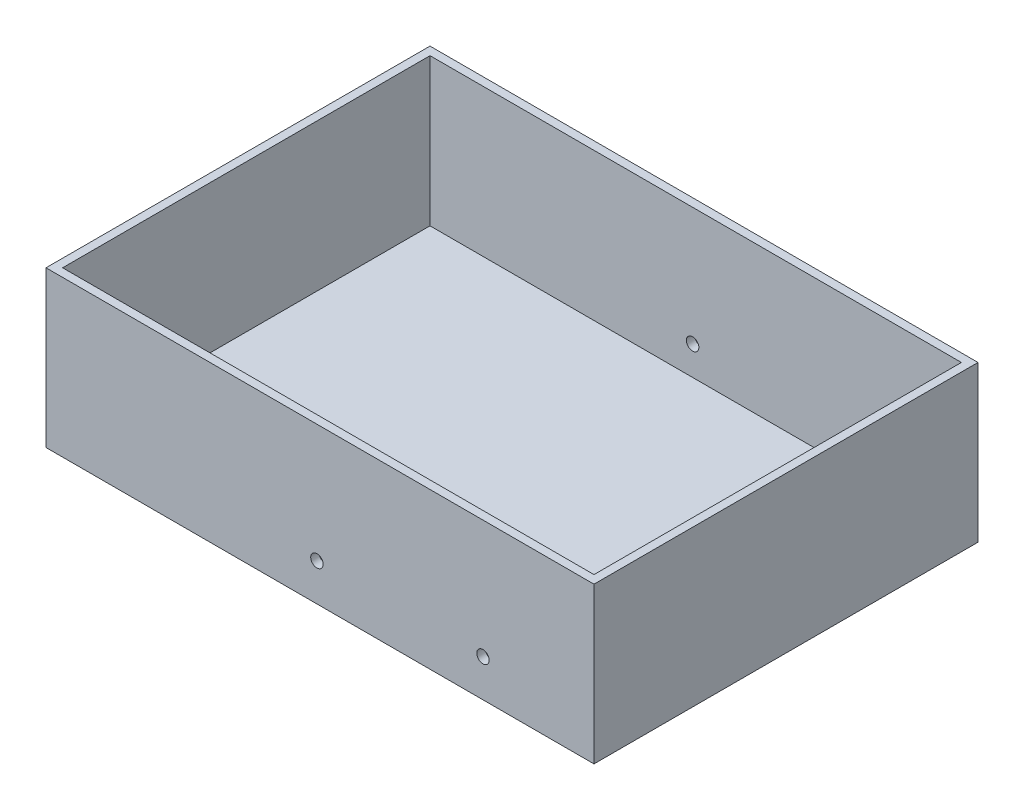
from build123d import *

# Parameters (mm, degrees)
SKETCH1_W           = 264
SKETCH1_H           = 185
SKETCH1_W_2         = 256
SKETCH1_H_2         = 177
BOSS_EXTRUDE4_DEPTH = 75
SKETCH6_W           = 256
SKETCH6_H           = 4
BOSS_EXTRUDE5_DEPTH = 177
SKETCH7_R           = 3
CUT_EXTRUDE1_DEPTH  = 185


with BuildPart() as part:
    # Sketch1 → Boss-Extrude4 (new body)
    with BuildSketch(Plane(origin=(0, 0, 0), x_dir=(1, 0, 0), z_dir=(0, 1, 0))):
        with Locations((1.484105733, 6.470202951)):
            Rectangle(SKETCH1_W, SKETCH1_H)
        with Locations((1.484105733, 6.470202951)):
            Rectangle(SKETCH1_W_2, SKETCH1_H_2, mode=Mode.SUBTRACT)
    extrude(amount=BOSS_EXTRUDE4_DEPTH)

    # Sketch6 → Boss-Extrude5 (add)
    with BuildSketch(Plane.XY.offset(-94.970202951)):
        with Locations((1.484105733, 2)):
            Rectangle(SKETCH6_W, SKETCH6_H)
    extrude(amount=BOSS_EXTRUDE5_DEPTH)

    # Sketch7 → Cut-Extrude1 (cut)
    with BuildSketch(Plane.XY.offset(86.029797049)):
        with Locations((0, 18)):
            Circle(SKETCH7_R)
        with Locations((80, 18)):
            Circle(SKETCH7_R)
    extrude(amount=-CUT_EXTRUDE1_DEPTH, mode=Mode.SUBTRACT)


solid = part.part
